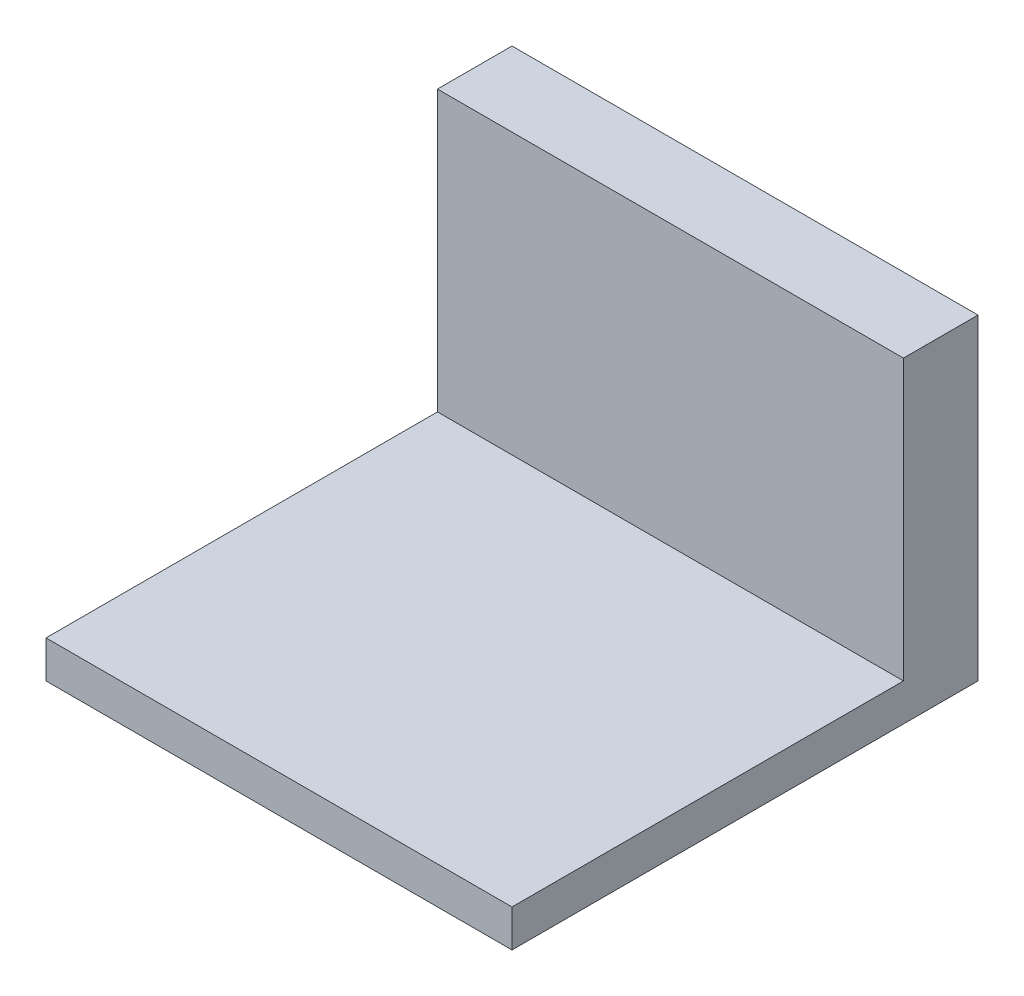
from build123d import *

# Parameters (mm, degrees)
SKETCH1_W           = 500
SKETCH1_H           = 500
BOSS_EXTRUDE1_DEPTH = 40
SKETCH2_W           = 500
SKETCH2_H           = 79.990648642
BOSS_EXTRUDE2_DEPTH = 300


with BuildPart() as part:
    # Sketch1 → Boss-Extrude1 (new body)
    with BuildSketch(Plane(origin=(0, 0, 0), x_dir=(1, 0, 0), z_dir=(0, 1, 0))):
        Rectangle(SKETCH1_W, SKETCH1_H)
    extrude(amount=BOSS_EXTRUDE1_DEPTH)

    # Sketch2 → Boss-Extrude2 (add)
    with BuildSketch(Plane(origin=(0, 40, 0), x_dir=(1, 0, 0), z_dir=(0, 1, 0))):
        with Locations((0, 210.004675679)):
            Rectangle(SKETCH2_W, SKETCH2_H)
    extrude(amount=BOSS_EXTRUDE2_DEPTH)


solid = part.part
